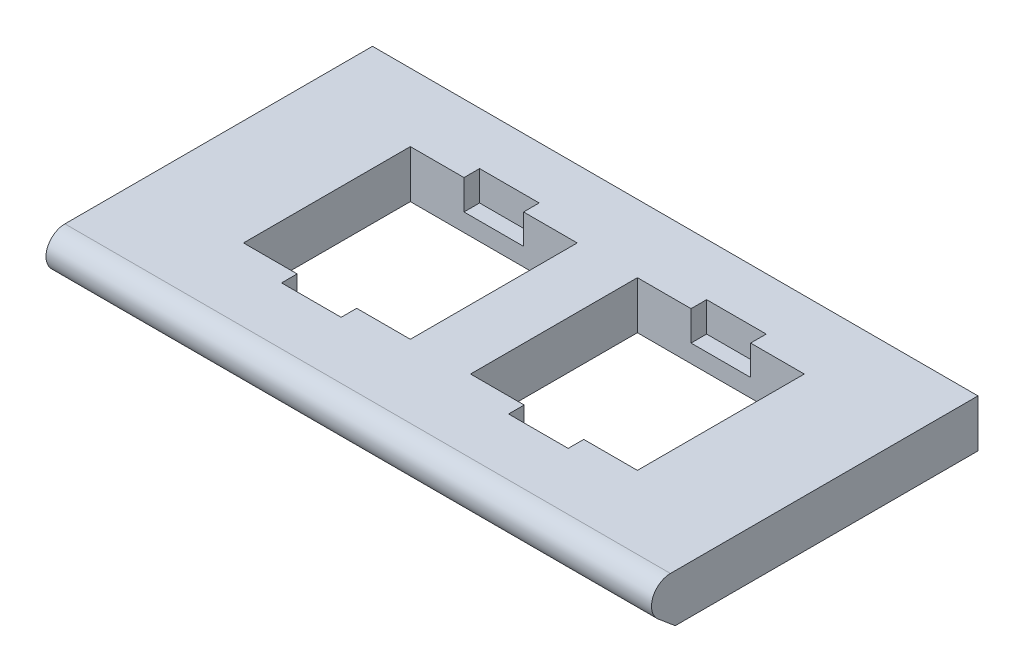
from build123d import *

# Parameters (mm, degrees)
SKETCH1_W               = 50.8
SKETCH1_H               = 25.4
BOSS_EXTRUDE1_DEPTH     = 3.999992
CUT_EXTRUDE1_DEPTH      = 57.936806514
CUT_EXTRUDE1_DEPTH_BACK = 57.936806514
SKETCH2_W               = 13.999972
SKETCH2_H               = 13.999972
SKETCH3_W               = 4.998974
SKETCH3_H               = 1.307084
CUT_EXTRUDE2_DEPTH      = 2.500122
BOSS_EXTRUDE2_DEPTH     = 50.8
FILLET1_R               = 1.5875


with BuildPart() as part:
    # Sketch1 → Boss-Extrude1 (new body)
    with BuildSketch(Plane(origin=(0, 0, 0), x_dir=(1, 0, 0), z_dir=(0, 1, 0))):
        with Locations((25.4, 12.7)):
            Rectangle(SKETCH1_W, SKETCH1_H)
    extrude(amount=BOSS_EXTRUDE1_DEPTH)

    # Sketch2 → Cut-Extrude1 (cut, two sides: drawn at the far end of the back side and taken through both)
    with BuildSketch(Plane(origin=(0, 3.999992, 0), x_dir=(1, 0, 0), z_dir=(0, 1, 0)).offset(-CUT_EXTRUDE1_DEPTH_BACK)):
        with Locations((15.875508, 12.7)):
            Rectangle(SKETCH2_W, SKETCH2_H)
        with Locations((34.924492, 12.7)):
            Rectangle(SKETCH2_W, SKETCH2_H)
    extrude(amount=CUT_EXTRUDE1_DEPTH + CUT_EXTRUDE1_DEPTH_BACK, mode=Mode.SUBTRACT)

    # Sketch3 → Cut-Extrude2 (cut)
    with BuildSketch(Plane(origin=(0, 3.999992, 0), x_dir=(1, 0, 0), z_dir=(0, 1, 0))):
        with Locations((15.875508, 20.353528)):
            Rectangle(SKETCH3_W, SKETCH3_H)
        with Locations((34.924492, 20.353528)):
            Rectangle(SKETCH3_W, SKETCH3_H)
        with Locations((34.924492, 5.046472)):
            Rectangle(SKETCH3_W, SKETCH3_H)
        with Locations((15.875508, 5.046472)):
            Rectangle(SKETCH3_W, SKETCH3_H)
    extrude(amount=-CUT_EXTRUDE2_DEPTH, mode=Mode.SUBTRACT)

    # Sketch5 → Boss-Extrude2 (add)
    with BuildSketch(Plane.ZY):
        Polygon((0, 0), (4.767004836, 3.999992), (0, 3.999992), align=None)
    extrude(amount=-BOSS_EXTRUDE2_DEPTH)

    # Fillet1
    fillet1_edges = [part.edges().sort_by_distance(p)[0] for p in [
        (25.4, 3.999992, 4.767004836),
    ]]
    fillet(fillet1_edges, radius=FILLET1_R)


solid = part.part
